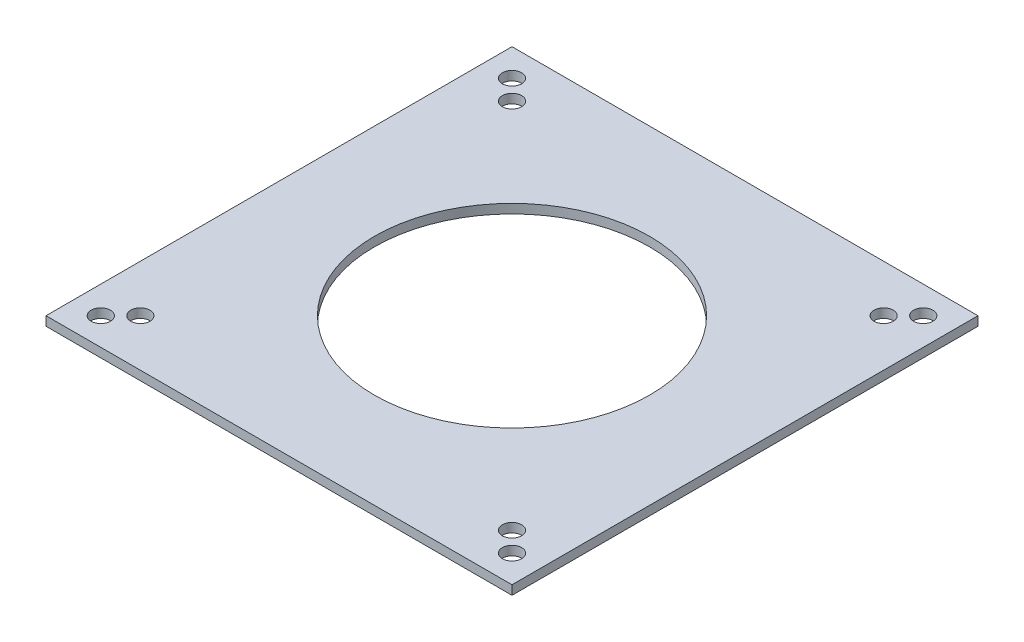
from build123d import *

# Parameters (mm, degrees)
SKETCH1_W           = 101.6
SKETCH1_H           = 101.6
SKETCH1_R           = 2.1
SKETCH1_R_2         = 30
BOSS_EXTRUDE1_DEPTH = 2


with BuildPart() as part:
    # Sketch1 → Boss-Extrude1 (new body)
    with BuildSketch(Plane(origin=(0, 0, 0), x_dir=(1, 0, 0), z_dir=(0, 1, 0))):
        Rectangle(SKETCH1_W, SKETCH1_H)
        with Locations(Location((-44.831, 44.831, 0), (0, 0, 270))):
            Circle(SKETCH1_R, mode=Mode.SUBTRACT)
        with Locations(Location((-40.513, 40.513, 0), (0, 0, 270))):
            Circle(SKETCH1_R, mode=Mode.SUBTRACT)
        with Locations(Location((44.831, 44.831, 0), (0, 0, 270))):
            Circle(SKETCH1_R, mode=Mode.SUBTRACT)
        with Locations(Location((40.513, 40.513, 0), (0, 0, 270))):
            Circle(SKETCH1_R, mode=Mode.SUBTRACT)
        with Locations(Location((44.831, -44.831, 0), (0, 0, 270))):
            Circle(SKETCH1_R, mode=Mode.SUBTRACT)
        with Locations(Location((40.513, -40.513, 0), (0, 0, 270))):
            Circle(SKETCH1_R, mode=Mode.SUBTRACT)
        with Locations(Location((-40.513, -40.513, 0), (0, 0, 270))):
            Circle(SKETCH1_R, mode=Mode.SUBTRACT)
        with Locations(Location((-44.831, -44.831, 0), (0, 0, 270))):
            Circle(SKETCH1_R, mode=Mode.SUBTRACT)
        with Locations(Location((0, 0, 0), (0, 0, 270))):
            Circle(SKETCH1_R_2, mode=Mode.SUBTRACT)
    extrude(amount=BOSS_EXTRUDE1_DEPTH)


solid = part.part
